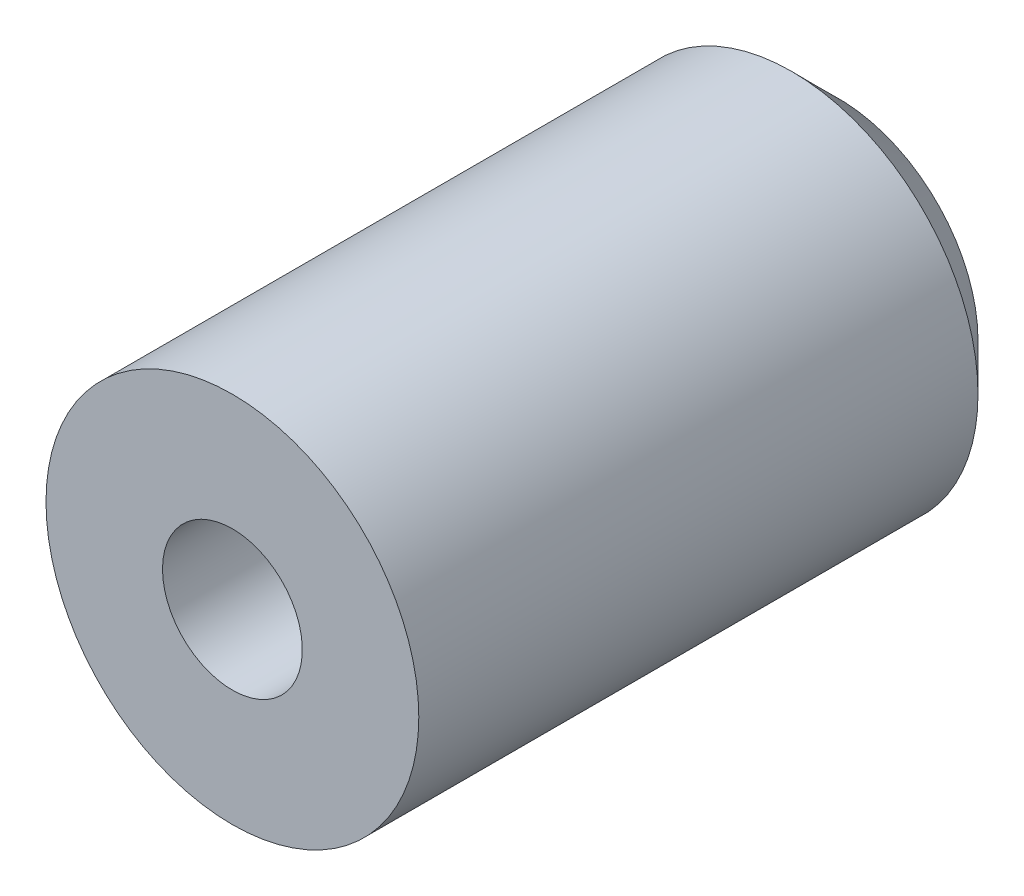
from build123d import *

# Parameters (mm, degrees)
ESQUISSE1_R        = 4
ESQUISSE1_R_2      = 1.5
BOSS_EXTRU_1_DEPTH = 13
CHANFREIN1_SIZE    = 1


with BuildPart() as part:
    # Esquisse1 → Boss.-Extru.1 (new body)
    with BuildSketch(Plane.XY):
        with Locations(Location((0, 0, 0), (0, 0, 180))):
            Circle(ESQUISSE1_R)
        with Locations(Location((0, 0, 0), (0, 0, 180))):
            Circle(ESQUISSE1_R_2, mode=Mode.SUBTRACT)
    extrude(amount=BOSS_EXTRU_1_DEPTH)

    # Chanfrein1
    chanfrein1_edges = [part.edges().sort_by_distance(p)[0] for p in [
        (4, 0, 0),
    ]]
    chamfer(chanfrein1_edges, length=CHANFREIN1_SIZE)


solid = part.part
